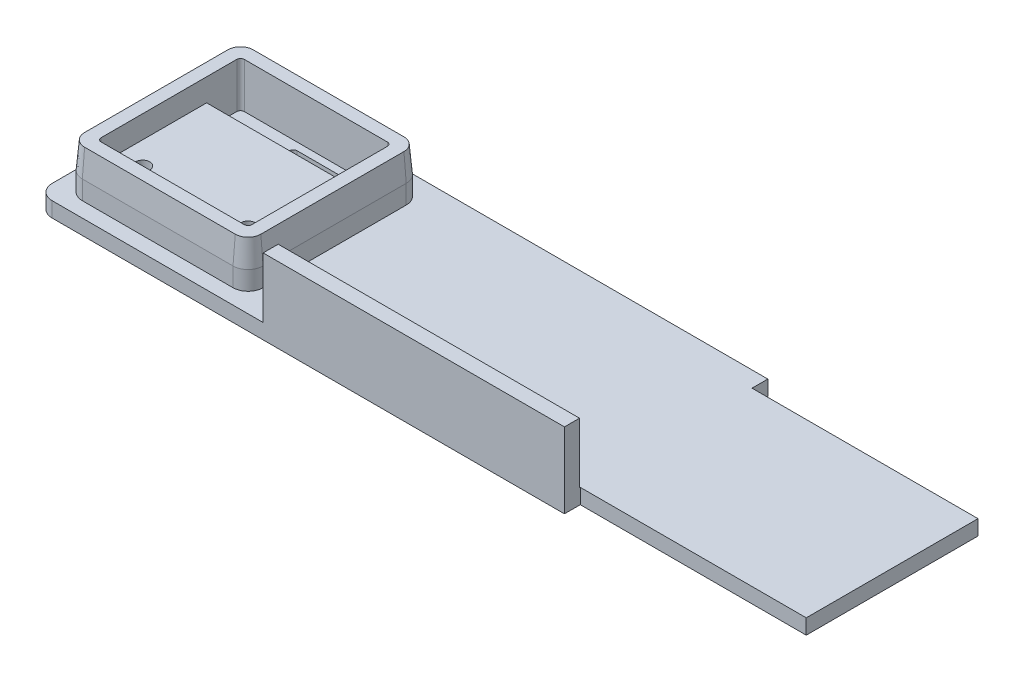
from build123d import *
from OCP.BRepFilletAPI import BRepFilletAPI_MakeChamfer

# Parameters (mm, degrees)
SKETCH1_W           = 28
SKETCH1_H           = 27
BOSS_EXTRUDE1_DEPTH = 2
SKETCH2_W           = 10
SKETCH2_H           = 2.5
CUT_EXTRUDE1_DEPTH  = 2
SKETCH3_W           = 20
SKETCH3_H           = 14.5
BOSS_EXTRUDE2_DEPTH = 3
SKETCH4_W           = 24
SKETCH4_H           = 23
SKETCH4_W_2         = 20
SKETCH4_H_2         = 19
BOSS_EXTRUDE3_DEPTH = 6
SKETCH5_R           = 0.95
CUT_EXTRUDE2_DEPTH  = 3.2
FILLET3_R           = 2
FILLET2_R           = 0.5
SKETCH6_W           = 27
SKETCH6_H           = 2
BOSS_EXTRUDE4_DEPTH = 72
CHAMFER1_SIZE       = 3.5
CHAMFER1_SIZE2      = 0.306210322
SKETCH7_W           = 30
SKETCH7_H           = 2.1
CUT_EXTRUDE3_DEPTH  = 88.259669951
SKETCH8_W           = 40
SKETCH8_H           = 8
BOSS_EXTRUDE5_DEPTH = 2


with BuildPart() as part:
    # Sketch1 → Boss-Extrude1 (new body)
    with BuildSketch(Plane(origin=(0, 0, 0), x_dir=(1, 0, 0), z_dir=(0, 1, 0))):
        Rectangle(SKETCH1_W, SKETCH1_H)
    extrude(amount=BOSS_EXTRUDE1_DEPTH)

    # Sketch2 → Cut-Extrude1 (cut)
    with BuildSketch(Plane(origin=(0, 2, 0), x_dir=(1, 0, 0), z_dir=(0, 1, 0))):
        with Locations((3, 7.25)):
            Rectangle(SKETCH2_W, SKETCH2_H)
    extrude(amount=-CUT_EXTRUDE1_DEPTH, mode=Mode.SUBTRACT)

    # Sketch3 → Boss-Extrude2 (add)
    with BuildSketch(Plane(origin=(0, 2, 0), x_dir=(1, 0, 0), z_dir=(0, 1, 0))):
        with Locations((0, -2.25)):
            Rectangle(SKETCH3_W, SKETCH3_H)
    extrude(amount=BOSS_EXTRUDE2_DEPTH)

    # Sketch4 → Boss-Extrude3 (add)
    with BuildSketch(Plane(origin=(0, 2, 0), x_dir=(1, 0, 0), z_dir=(0, 1, 0))):
        Rectangle(SKETCH4_W, SKETCH4_H)
        Rectangle(SKETCH4_W_2, SKETCH4_H_2, mode=Mode.SUBTRACT)
    extrude(amount=BOSS_EXTRUDE3_DEPTH)

    # Sketch5 → Cut-Extrude2 (cut)
    with BuildSketch(Plane(origin=(0, 5, 0), x_dir=(1, 0, 0), z_dir=(0, 1, 0))):
        with Locations(Location((-7, -6.5, 0), (0, 0, 270))):
            Circle(SKETCH5_R)
        with Locations(Location((7, -6.5, 0), (0, 0, 90))):
            Circle(SKETCH5_R)
    extrude(amount=-CUT_EXTRUDE2_DEPTH, mode=Mode.SUBTRACT)

    # Fillet3
    fillet3_edges = [part.edges().sort_by_distance(p)[0] for p in [
        (12, 5, -11.5),
        (-12, 5, -11.5),
        (-12, 5, 11.5),
        (12, 5, 11.5),
        (-14, 1, 13.5),
        (-14, 1, -13.5),
    ]]
    fillet(fillet3_edges, radius=FILLET3_R)

    # Fillet2
    fillet2_edges = [part.edges().sort_by_distance(p)[0] for p in [
        (-2, 1, -8.5),
        (-2, 1, -6),
        (8, 1, -6),
        (8, 1, -8.5),
        (10, 5, -9.5),
        (-10, 6.5, 9.5),
        (10, 6.5, 9.5),
        (-10, 5, -9.5),
    ]]
    fillet(fillet2_edges, radius=FILLET2_R)

    # Sketch6 → Boss-Extrude4 (add)
    with BuildSketch(Plane(origin=(14, 0, 0), x_dir=(0, 0, -1), z_dir=(1, 0, 0))):
        with Locations((0, 1)):
            Rectangle(SKETCH6_W, SKETCH6_H)
    extrude(amount=BOSS_EXTRUDE4_DEPTH)

    # Chamfer1: one chamfer whose edges measure the first distance from different faces: ONE call of the kernel's chamfer builder (chamfer() names one face for all edges)
    chamfer1_edges_1 = [part.edges().sort_by_distance(p)[0] for p in [
        (0, 8, -11.5),
    ]]
    chamfer1_side_1 = [part.faces().sort_by_distance(p)[0] for p in [
        (0, 5, -11.5),
    ]]
    chamfer1_edges_2 = [part.edges().sort_by_distance(p)[0] for p in [
        (12, 8, 0),
    ]]
    chamfer1_side_2 = [part.faces().sort_by_distance(p)[0] for p in [
        (12, 5, 0),
    ]]
    chamfer1_edges_3 = [part.edges().sort_by_distance(p)[0] for p in [
        (-12, 8, 0),
    ]]
    chamfer1_side_3 = [part.faces().sort_by_distance(p)[0] for p in [
        (-12, 5, 0),
    ]]
    chamfer1_edges_4 = [part.edges().sort_by_distance(p)[0] for p in [
        (0, 8, 11.5),
    ]]
    chamfer1_side_4 = [part.faces().sort_by_distance(p)[0] for p in [
        (0, 5, 11.5),
    ]]
    chamfer1_edges_5 = [part.edges().sort_by_distance(p)[0] for p in [
        (-11.414213562, 8, -10.914213562),
    ]]
    chamfer1_side_5 = [part.faces().sort_by_distance(p)[0] for p in [
        (-11.414213562, 5, -10.914213562),
    ]]
    chamfer1_edges_6 = [part.edges().sort_by_distance(p)[0] for p in [
        (-11.414213562, 8, 10.914213562),
    ]]
    chamfer1_side_6 = [part.faces().sort_by_distance(p)[0] for p in [
        (-11.414213562, 5, 10.914213562),
    ]]
    chamfer1_edges_7 = [part.edges().sort_by_distance(p)[0] for p in [
        (11.414213562, 8, 10.914213562),
    ]]
    chamfer1_side_7 = [part.faces().sort_by_distance(p)[0] for p in [
        (11.414213562, 5, 10.914213562),
    ]]
    chamfer1_edges_8 = [part.edges().sort_by_distance(p)[0] for p in [
        (11.414213562, 8, -10.914213562),
    ]]
    chamfer1_side_8 = [part.faces().sort_by_distance(p)[0] for p in [
        (11.414213562, 5, -10.914213562),
    ]]
    chamfer1 = BRepFilletAPI_MakeChamfer(part.part.solid().wrapped)
    for e in chamfer1_edges_1:
        chamfer1.Add(CHAMFER1_SIZE, CHAMFER1_SIZE2, e.wrapped, chamfer1_side_1[0].wrapped)  # the first distance lies on this face
    for e in chamfer1_edges_2:
        chamfer1.Add(CHAMFER1_SIZE, CHAMFER1_SIZE2, e.wrapped, chamfer1_side_2[0].wrapped)  # the first distance lies on this face
    for e in chamfer1_edges_3:
        chamfer1.Add(CHAMFER1_SIZE, CHAMFER1_SIZE2, e.wrapped, chamfer1_side_3[0].wrapped)  # the first distance lies on this face
    for e in chamfer1_edges_4:
        chamfer1.Add(CHAMFER1_SIZE, CHAMFER1_SIZE2, e.wrapped, chamfer1_side_4[0].wrapped)  # the first distance lies on this face
    for e in chamfer1_edges_5:
        chamfer1.Add(CHAMFER1_SIZE, CHAMFER1_SIZE2, e.wrapped, chamfer1_side_5[0].wrapped)  # the first distance lies on this face
    for e in chamfer1_edges_6:
        chamfer1.Add(CHAMFER1_SIZE, CHAMFER1_SIZE2, e.wrapped, chamfer1_side_6[0].wrapped)  # the first distance lies on this face
    for e in chamfer1_edges_7:
        chamfer1.Add(CHAMFER1_SIZE, CHAMFER1_SIZE2, e.wrapped, chamfer1_side_7[0].wrapped)  # the first distance lies on this face
    for e in chamfer1_edges_8:
        chamfer1.Add(CHAMFER1_SIZE, CHAMFER1_SIZE2, e.wrapped, chamfer1_side_8[0].wrapped)  # the first distance lies on this face
    add(Compound.cast(chamfer1.Shape()), mode=Mode.REPLACE)

    # Sketch7 → Cut-Extrude3 (cut, through all)
    with BuildSketch(Plane(origin=(0, 2, 0), x_dir=(1, 0, 0), z_dir=(0, 1, 0))):
        with Locations((71, 12.45)):
            Rectangle(SKETCH7_W, SKETCH7_H)
    cut_extrude3 = extrude(amount=-CUT_EXTRUDE3_DEPTH, mode=Mode.SUBTRACT)

    # Mirror1: Cut-Extrude3 across plane
    add(cut_extrude3.mirror(Plane.XY), mode=Mode.SUBTRACT)

    # Sketch8 → Boss-Extrude5 (add)
    with BuildSketch(Plane.XY.offset(13.5)):
        with Locations((36, 6)):
            Rectangle(SKETCH8_W, SKETCH8_H)
    extrude(amount=-BOSS_EXTRUDE5_DEPTH)


solid = part.part
